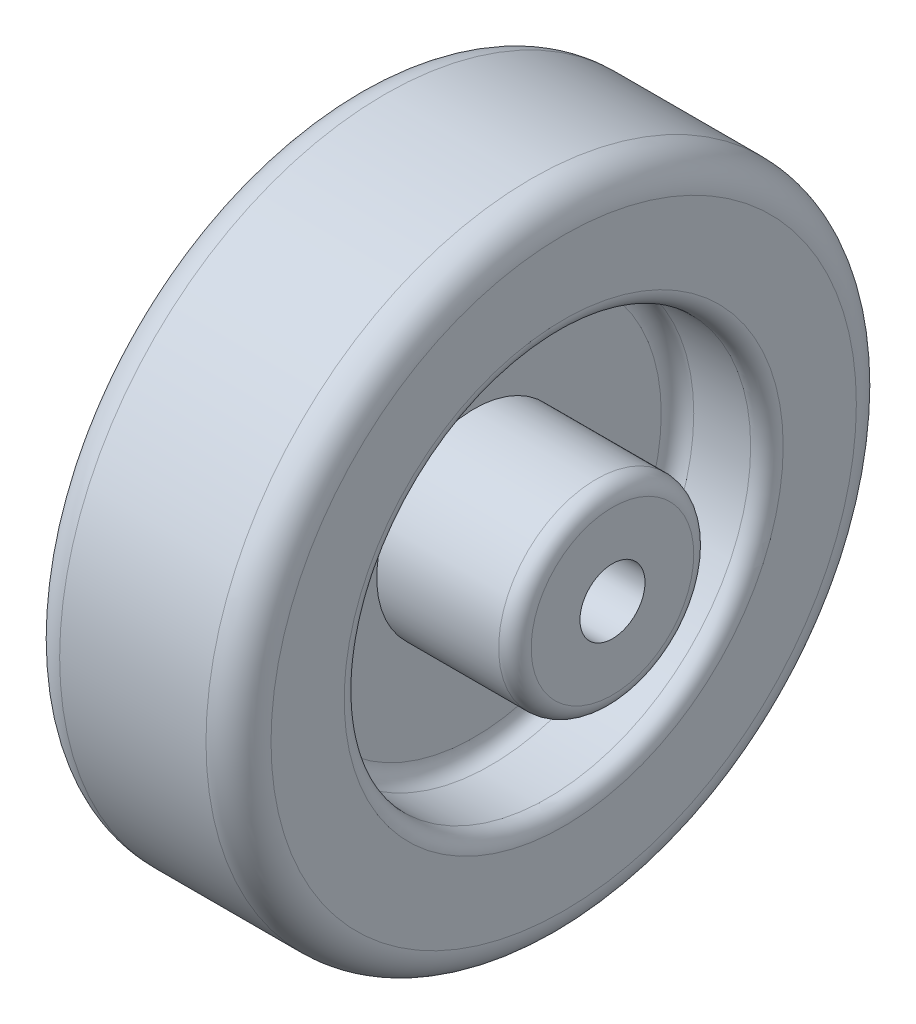
from build123d import *

# Parameters (mm, degrees)
SKETCH1_R            = 40
BOSS_EXTRUDE1_DEPTH  = 13
SKETCH2_R            = 25
CUT_EXTRUDE1_DEPTH   = 11
SKETCH3_R            = 12
BOSS_EXTRUDE2_DEPTH  = 17
SKETCH4_R            = 4
CUT_EXTRUDE2_DEPTH   = 60.674114991
FILLET1_R            = 2
FILLET2_R            = 4
FILLET1_OF_MIRROR2_R = 2
FILLET2_OF_MIRROR2_R = 4


with BuildPart() as part:
    # Sketch1 → Boss-Extrude1 (new body)
    with BuildSketch(Plane(origin=(0, 0, 0), x_dir=(0, 0, -1), z_dir=(1, 0, 0))):
        with Locations(Location((0, 0, 0), (0, 0, 180))):
            Circle(SKETCH1_R)
    boss_extrude1 = extrude(amount=BOSS_EXTRUDE1_DEPTH)

    # Sketch2 → Cut-Extrude1 (cut)
    with BuildSketch(Plane(origin=(13, 0, 0), x_dir=(0, 0, -1), z_dir=(1, 0, 0))):
        Circle(SKETCH2_R)
    cut_extrude1 = extrude(amount=-CUT_EXTRUDE1_DEPTH, mode=Mode.SUBTRACT)

    # Sketch3 → Boss-Extrude2 (add)
    with BuildSketch(Plane(origin=(2, 0, 0), x_dir=(0, 0, -1), z_dir=(1, 0, 0))):
        Circle(SKETCH3_R)
    boss_extrude2 = extrude(amount=BOSS_EXTRUDE2_DEPTH)

    # Sketch4 → Cut-Extrude2 (cut, through all)
    with BuildSketch(Plane(origin=(19, 0, 0), x_dir=(0, 0, -1), z_dir=(1, 0, 0))):
        Circle(SKETCH4_R)
    cut_extrude2 = extrude(amount=-CUT_EXTRUDE2_DEPTH, mode=Mode.SUBTRACT)

    # Fillet1
    fillet1_edges = [part.edges().sort_by_distance(p)[0] for p in [
        (19, 0, 12),
        (2, 0, 25),
        (13, 0, 25),
    ]]
    fillet(fillet1_edges, radius=FILLET1_R)

    # Fillet2
    fillet2_edges = [part.edges().sort_by_distance(p)[0] for p in [
        (13, 0, -40),
    ]]
    fillet(fillet2_edges, radius=FILLET2_R)

    # Mirror2: Boss-Extrude1, Cut-Extrude1, Boss-Extrude2, Cut-Extrude2 across plane
    add(boss_extrude1.mirror(Plane(origin=(0, 0, 0), x_dir=(0, 0, 1), z_dir=(1, 0, 0))))
    add(cut_extrude1.mirror(Plane(origin=(0, 0, 0), x_dir=(0, 0, 1), z_dir=(1, 0, 0))), mode=Mode.SUBTRACT)
    add(boss_extrude2.mirror(Plane(origin=(0, 0, 0), x_dir=(0, 0, 1), z_dir=(1, 0, 0))))
    add(cut_extrude2.mirror(Plane(origin=(0, 0, 0), x_dir=(0, 0, 1), z_dir=(1, 0, 0))), mode=Mode.SUBTRACT)

    # Fillet1 of Mirror2
    fillet1_of_mirror2_edges = [part.edges().sort_by_distance(p)[0] for p in [
        (-19, 0, 12),
        (-2, 0, 25),
        (-13, 0, 25),
    ]]
    fillet(fillet1_of_mirror2_edges, radius=FILLET1_OF_MIRROR2_R)

    # Fillet2 of Mirror2
    fillet2_of_mirror2_edges = [part.edges().sort_by_distance(p)[0] for p in [
        (-13, 0, -40),
    ]]
    fillet(fillet2_of_mirror2_edges, radius=FILLET2_OF_MIRROR2_R)


solid = part.part
